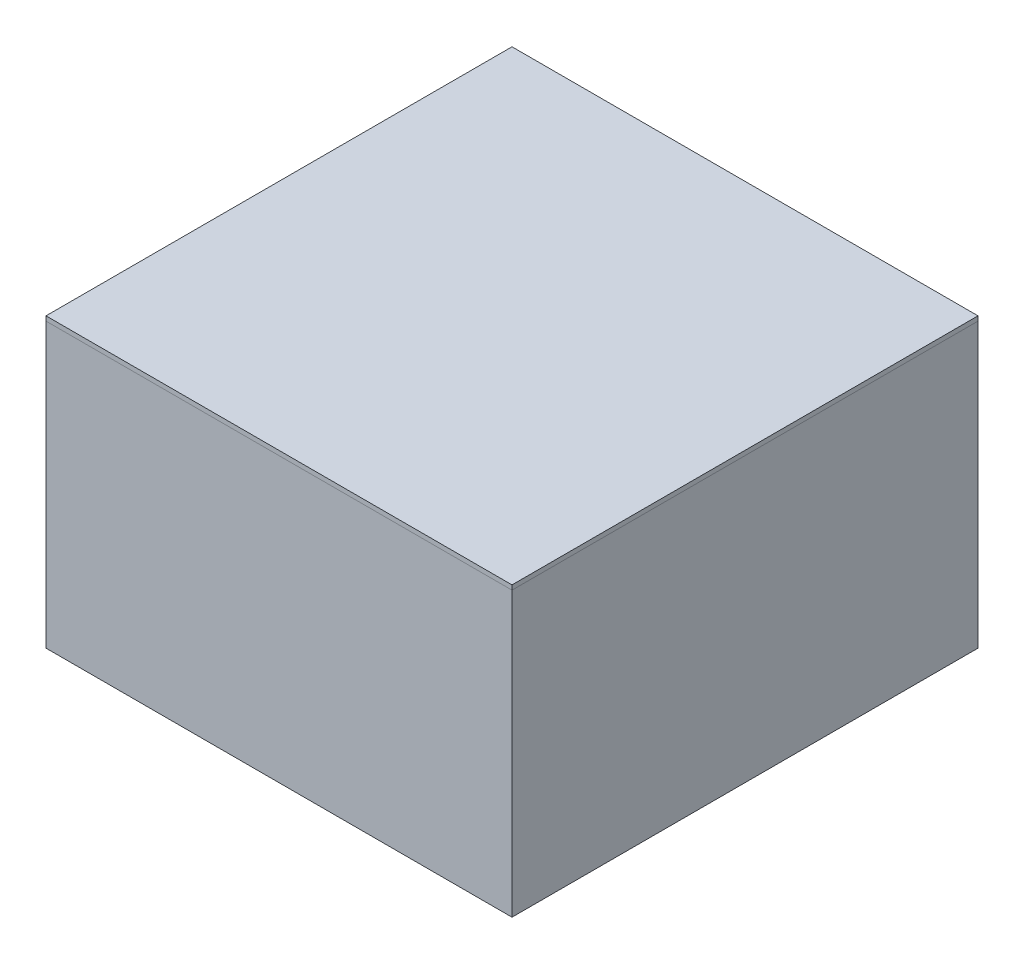
from build123d import *

# Parameters (mm, degrees)
SKETCH2_W           = 102
SKETCH2_H           = 102
BOSS_EXTRUDE1_DEPTH = 31
SHELL1_T            = -1
SKETCH3_W           = 99.8
SKETCH3_H           = 99.8
BOSS_EXTRUDE2_DEPTH = 1.5
SKETCH4_W           = 102
SKETCH4_H           = 102
BOSS_EXTRUDE3_DEPTH = 1


with BuildPart() as part:
    # Sketch2 → Boss-Extrude1 (new, symmetric)
    with BuildSketch(Plane(origin=(0, 0, 0), x_dir=(1, 0, 0), z_dir=(0, 1, 0))):
        Rectangle(SKETCH2_W, SKETCH2_H)
    extrude(amount=BOSS_EXTRUDE1_DEPTH, both=True)

    # Shell1
    shell1_openings = [part.faces().sort_by_distance(p)[0] for p in [
        (0, 31, 0),
    ]]
    offset(amount=SHELL1_T, openings=shell1_openings, kind=Kind.INTERSECTION)


with BuildPart() as body_2:
    # Sketch3 → Boss-Extrude2 (new body)
    with BuildSketch(Plane(origin=(0, 31, 0), x_dir=(1, 0, 0), z_dir=(0, 1, 0))):
        Rectangle(SKETCH3_W, SKETCH3_H)
    extrude(amount=-BOSS_EXTRUDE2_DEPTH)

    # Sketch4 → Boss-Extrude3 (add)
    with BuildSketch(Plane(origin=(0, 31, 0), x_dir=(1, 0, 0), z_dir=(0, 1, 0))):
        Rectangle(SKETCH4_W, SKETCH4_H)
    extrude(amount=BOSS_EXTRUDE3_DEPTH)


solid = Compound([part.part, body_2.part])
